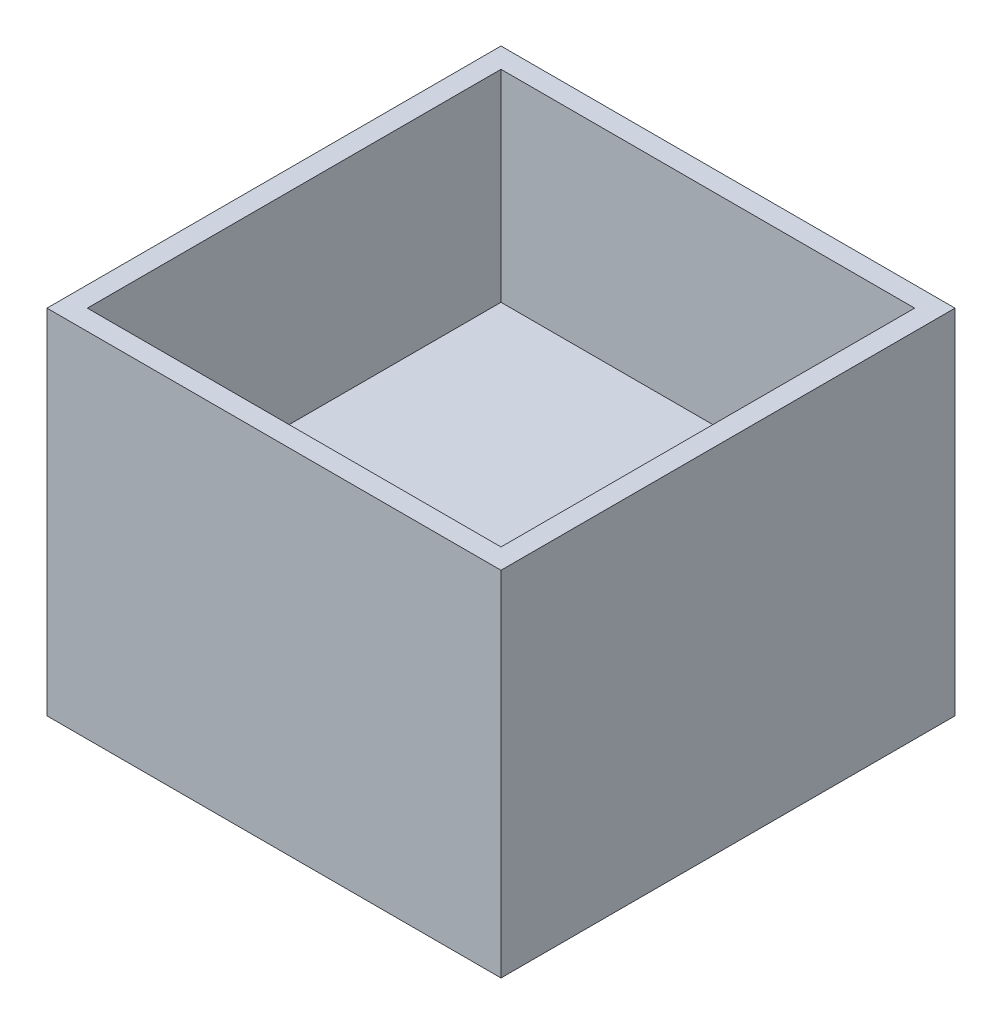
from build123d import *

# Parameters (mm, degrees)
SKETCH1_W           = 45
SKETCH1_H           = 45
BOSS_EXTRUDE1_DEPTH = 35
SKETCH3_W           = 41
SKETCH3_H           = 41
CUT_EXTRUDE2_DEPTH  = 20


with BuildPart() as part:
    # Sketch1 → Boss-Extrude1 (new body)
    with BuildSketch(Plane(origin=(0, 0, 0), x_dir=(1, 0, 0), z_dir=(0, 1, 0))):
        with Locations((22.5, 22.5)):
            Rectangle(SKETCH1_W, SKETCH1_H)
    extrude(amount=BOSS_EXTRUDE1_DEPTH)

    # Sketch3 → Cut-Extrude2 (cut)
    with BuildSketch(Plane(origin=(0, 35, 0), x_dir=(1, 0, 0), z_dir=(0, 1, 0))):
        with Locations((22.5, 22.5)):
            Rectangle(SKETCH3_W, SKETCH3_H)
    extrude(amount=-CUT_EXTRUDE2_DEPTH, mode=Mode.SUBTRACT)


solid = part.part
